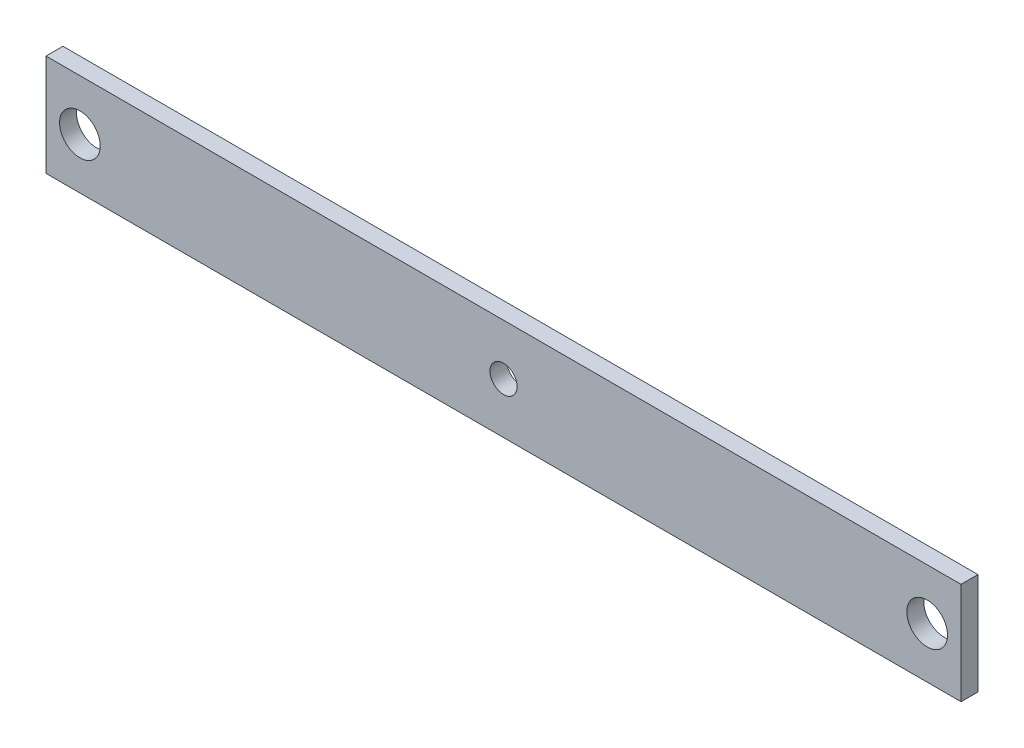
from build123d import *

# Parameters (mm, degrees)
SKETCH_1_W      = 270
SKETCH_1_H      = 30
SKETCH_1_R      = 6
SKETCH_1_R_2    = 4
EXTRUDE_1_DEPTH = 5


with BuildPart() as part:
    # 草图1 → 凸台-拉伸1 (new body)
    with BuildSketch(Plane.XY):
        Rectangle(SKETCH_1_W, SKETCH_1_H)
        with Locations((-125, 0)):
            Circle(SKETCH_1_R, mode=Mode.SUBTRACT)
        with Locations((125, 0)):
            Circle(SKETCH_1_R, mode=Mode.SUBTRACT)
        Circle(SKETCH_1_R_2, mode=Mode.SUBTRACT)
    extrude(amount=EXTRUDE_1_DEPTH)


solid = part.part
